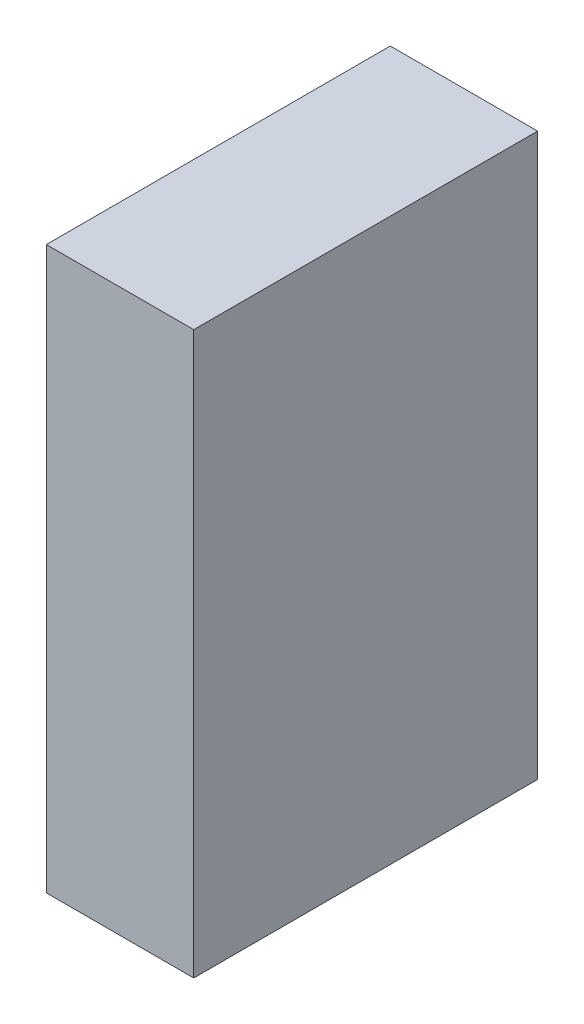
from build123d import *

# Parameters (mm, degrees)
SZKIC1_W                    = 98
SZKIC1_H                    = 160
DODANIE_WYCI_GNI_CIE1_DEPTH = 42


with BuildPart() as part:
    # Szkic1 → Dodanie-wyciągnięcie1 (new body)
    with BuildSketch(Plane(origin=(0, 0, 0), x_dir=(0, 0, -1), z_dir=(1, 0, 0))):
        with Locations((49, 80)):
            Rectangle(SZKIC1_W, SZKIC1_H)
    extrude(amount=DODANIE_WYCI_GNI_CIE1_DEPTH)


solid = part.part
